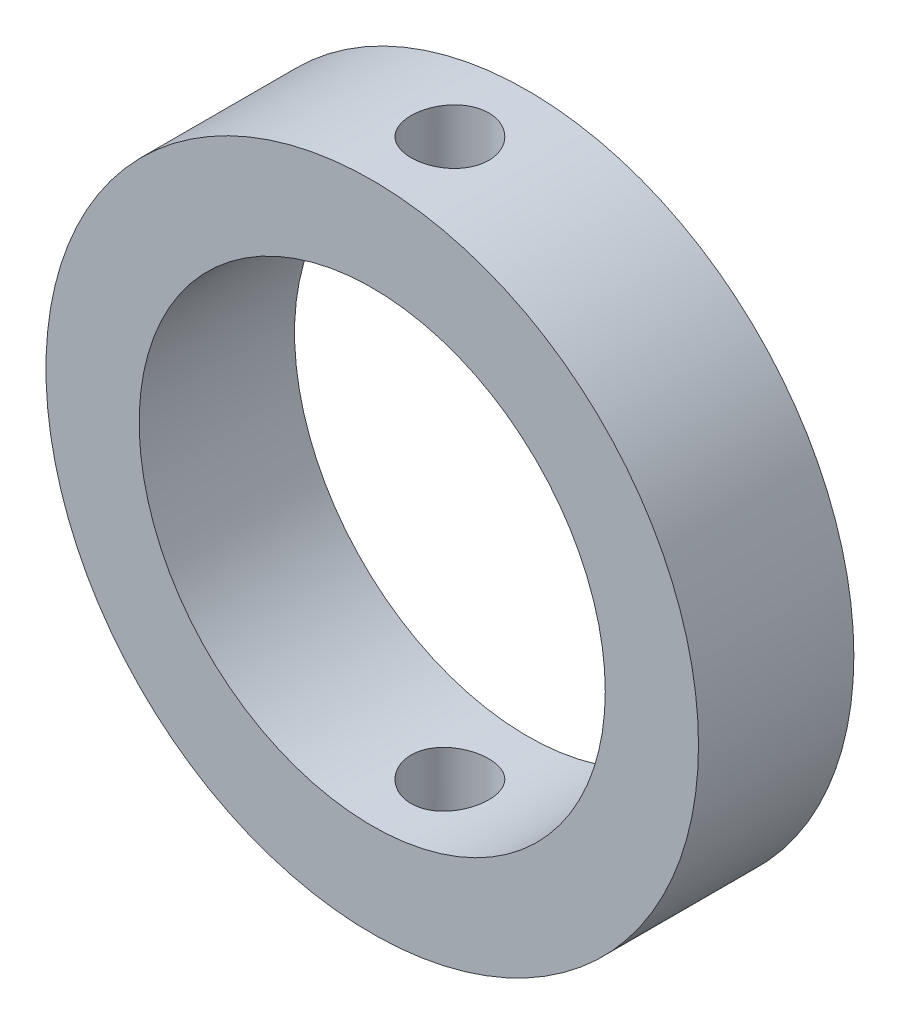
from build123d import *

# Parameters (mm, degrees)
SKETCH1_R               = 42
SKETCH1_R_2             = 30
BOSS_EXTRUDE1_DEPTH     = 20
CUT_EXTRUDE1_DEPTH      = 63.673758464
CUT_EXTRUDE1_DEPTH_BACK = 63.673758464
SKETCH2_R               = 5


with BuildPart() as part:
    # Sketch1 → Boss-Extrude1 (new body)
    with BuildSketch(Plane.XY):
        Circle(SKETCH1_R)
        Circle(SKETCH1_R_2, mode=Mode.SUBTRACT)
    extrude(amount=BOSS_EXTRUDE1_DEPTH)

    # Sketch2 → Cut-Extrude1 (cut, two sides: drawn at the far end of the back side and taken through both)
    with BuildSketch(Plane(origin=(0, 0, 0), x_dir=(1, 0, 0), z_dir=(0, 1, 0)).offset(-CUT_EXTRUDE1_DEPTH_BACK)):
        with Locations(Location((0, -10, 0), (0, 0, 270))):
            Circle(SKETCH2_R)
    extrude(amount=CUT_EXTRUDE1_DEPTH + CUT_EXTRUDE1_DEPTH_BACK, mode=Mode.SUBTRACT)


solid = part.part
